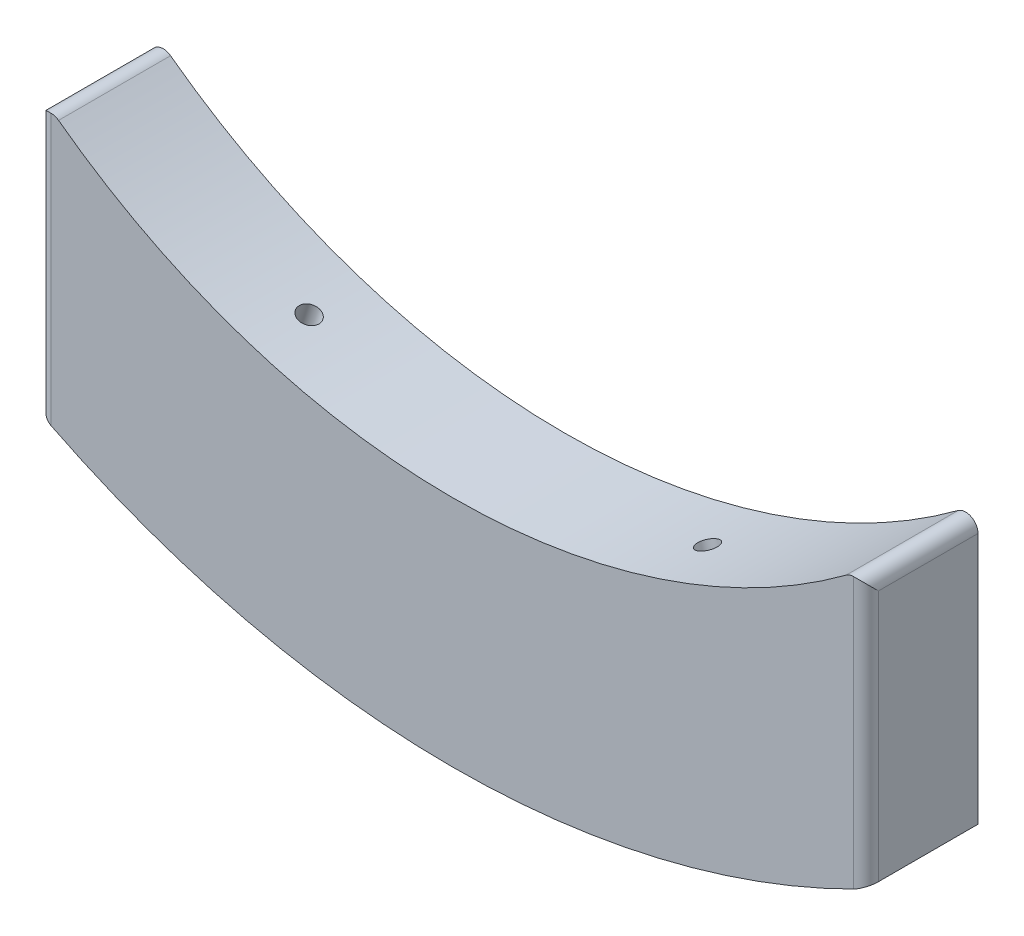
from build123d import *

# Parameters (mm, degrees)
BOSS_EXTRUDE1_DEPTH                   = 9
BOSS_EXTRUDE1_DEPTH_BACK              = 9
TAP_DRILL_FOR_M4_TAP1_D               = 3.3
TAP_DRILL_FOR_M4_TAP1_DEPTH           = 25
TAP_DRILL_FOR_M4_TAP1_TIP             = 0.991420021
TAP_DRILL_FOR_M4_TAP1_ON_FACE_2_D     = 3.3
TAP_DRILL_FOR_M4_TAP1_ON_FACE_2_DEPTH = 25
TAP_DRILL_FOR_M4_TAP1_ON_FACE_2_TIP   = 0.991420021
TAP_DRILL_FOR_M4_TAP1_ON_FACE_3_D     = 3.3
TAP_DRILL_FOR_M4_TAP1_ON_FACE_3_DEPTH = 25
TAP_DRILL_FOR_M4_TAP1_ON_FACE_3_TIP   = 0.991420021
TAP_DRILL_FOR_M4_TAP1_ON_FACE_4_D     = 3.3
TAP_DRILL_FOR_M4_TAP1_ON_FACE_4_DEPTH = 25
TAP_DRILL_FOR_M4_TAP1_ON_FACE_4_TIP   = 0.991420021
TAP_DRILL_FOR_M4_TAP1_ON_FACE_5_D     = 3.3
TAP_DRILL_FOR_M4_TAP1_ON_FACE_5_DEPTH = 25
TAP_DRILL_FOR_M4_TAP1_ON_FACE_5_TIP   = 0.991420021
FILLET2_R                             = 2


with BuildPart() as part:
    # Sketch1 → Boss-Extrude1 (new, two sides: drawn at the far end of the back side and taken through both)
    with BuildSketch(Plane.XY.offset(-BOSS_EXTRUDE1_DEPTH_BACK)):
        with BuildLine():
            Line((66.491800306, -127.729559978), (66.491800306, -83.193091613))
            ThreePointArc((66.491800306, -83.193091613), (0, -106.5), (-66.491800306, -83.193091613))
            Line((-66.491800306, -83.193091613), (-66.491800306, -127.729559978))
            ThreePointArc((-66.491800306, -127.729559978), (0, -144), (66.491800306, -127.729559978))
        make_face()
    extrude(amount=BOSS_EXTRUDE1_DEPTH + BOSS_EXTRUDE1_DEPTH_BACK)

    # Tap Drill for M4 Tap1
    with Locations(Plane(origin=(-32.025167647, -101.570855255, 0), x_dir=(0.953716950748, -0.300705799504, 0), z_dir=(0.300705799504, 0.953716950748, 0))):
        with Locations((0, 0)):
            Hole(TAP_DRILL_FOR_M4_TAP1_D / 2, depth=TAP_DRILL_FOR_M4_TAP1_DEPTH)
            with Locations((0, 0, -(TAP_DRILL_FOR_M4_TAP1_DEPTH + TAP_DRILL_FOR_M4_TAP1_TIP / 2))):  # 118° drill point
                Cone(0, TAP_DRILL_FOR_M4_TAP1_D / 2, TAP_DRILL_FOR_M4_TAP1_TIP, mode=Mode.SUBTRACT)

    # Tap Drill for M4 Tap1 on face 2
    with Locations(Plane(origin=(32.025167647, -101.570855255, 0), x_dir=(0.953716897702, 0.300705967746, 0), z_dir=(-0.300705967746, 0.953716897702, 0))):
        with Locations((0, 0)):
            Hole(TAP_DRILL_FOR_M4_TAP1_ON_FACE_2_D / 2, depth=TAP_DRILL_FOR_M4_TAP1_ON_FACE_2_DEPTH)
            with Locations((0, 0, -(TAP_DRILL_FOR_M4_TAP1_ON_FACE_2_DEPTH + TAP_DRILL_FOR_M4_TAP1_ON_FACE_2_TIP / 2))):  # 118° drill point
                Cone(0, TAP_DRILL_FOR_M4_TAP1_ON_FACE_2_D / 2, TAP_DRILL_FOR_M4_TAP1_ON_FACE_2_TIP, mode=Mode.SUBTRACT)

    # Tap Drill for M4 Tap1 on face 3
    with Locations(Plane(origin=(-55.106414261, -133.038652682, 0), x_dir=(-0.923879753837, 0.382682898036, 0), z_dir=(-0.382682898036, -0.923879753837, 0))):
        with Locations((0, 0)):
            Hole(TAP_DRILL_FOR_M4_TAP1_ON_FACE_3_D / 2, depth=TAP_DRILL_FOR_M4_TAP1_ON_FACE_3_DEPTH)
            with Locations((0, 0, -(TAP_DRILL_FOR_M4_TAP1_ON_FACE_3_DEPTH + TAP_DRILL_FOR_M4_TAP1_ON_FACE_3_TIP / 2))):  # 118° drill point
                Cone(0, TAP_DRILL_FOR_M4_TAP1_ON_FACE_3_D / 2, TAP_DRILL_FOR_M4_TAP1_ON_FACE_3_TIP, mode=Mode.SUBTRACT)

    # Tap Drill for M4 Tap1 on face 4
    with Locations(Plane(origin=(0, -144, 0), x_dir=(0, 0, -1), z_dir=(0, -1, 0))):
        with Locations((0, 0)):
            Hole(TAP_DRILL_FOR_M4_TAP1_ON_FACE_4_D / 2, depth=TAP_DRILL_FOR_M4_TAP1_ON_FACE_4_DEPTH)
            with Locations((0, 0, -(TAP_DRILL_FOR_M4_TAP1_ON_FACE_4_DEPTH + TAP_DRILL_FOR_M4_TAP1_ON_FACE_4_TIP / 2))):  # 118° drill point
                Cone(0, TAP_DRILL_FOR_M4_TAP1_ON_FACE_4_D / 2, TAP_DRILL_FOR_M4_TAP1_ON_FACE_4_TIP, mode=Mode.SUBTRACT)

    # Tap Drill for M4 Tap1 on face 5
    with Locations(Plane(origin=(55.106414261, -133.038652682, 0), x_dir=(-0.923879753837, -0.382682898036, 0), z_dir=(0.382682898036, -0.923879753837, 0))):
        with Locations((0, 0)):
            Hole(TAP_DRILL_FOR_M4_TAP1_ON_FACE_5_D / 2, depth=TAP_DRILL_FOR_M4_TAP1_ON_FACE_5_DEPTH)
            with Locations((0, 0, -(TAP_DRILL_FOR_M4_TAP1_ON_FACE_5_DEPTH + TAP_DRILL_FOR_M4_TAP1_ON_FACE_5_TIP / 2))):  # 118° drill point
                Cone(0, TAP_DRILL_FOR_M4_TAP1_ON_FACE_5_D / 2, TAP_DRILL_FOR_M4_TAP1_ON_FACE_5_TIP, mode=Mode.SUBTRACT)

    # Fillet2
    fillet2_edges = [part.edges().sort_by_distance(p)[0] for p in [
        (-66.491800306, -83.193091613, 0),
        (66.491800306, -83.193091613, 0),
        (66.491800306, -105.461325795, 9),
        (-66.491800306, -105.461325795, 9),
    ]]
    fillet(fillet2_edges, radius=FILLET2_R)


solid = part.part
